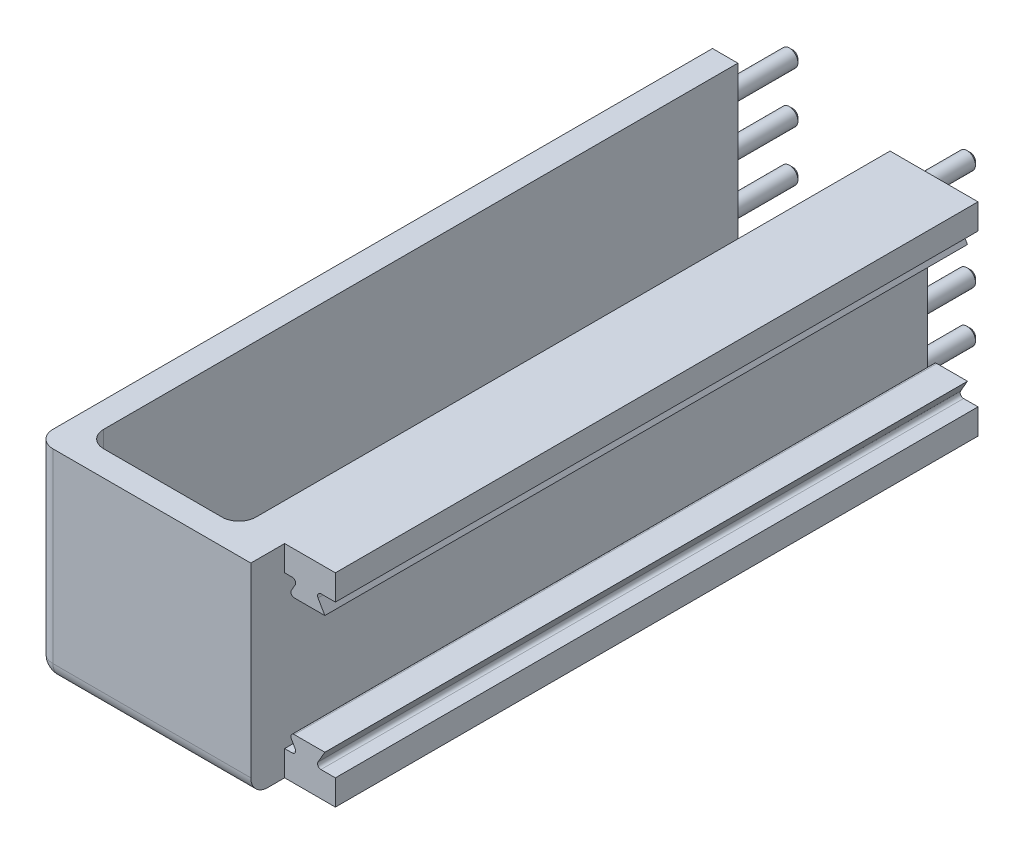
from build123d import *

# Parameters (mm, degrees)
SURFACE_EXTRUDE1_1_DEPTH = 120
THICKEN1_T2              = 15
SKETCH5_W                = 90
SKETCH5_H                = 120
CUT_EXTRUDE1_DEPTH       = 120
SKETCH4_W                = 120
SKETCH4_H                = 400
THICKEN2_T1              = 12
FILLET1_R                = 10
FILLET2_R                = 10
SKETCH6_R                = 5
BOSS_EXTRUDE1_DEPTH      = 40
CHAMFER1_SIZE            = 2
CHAMFER2_SIZE            = 2
SKETCH7_W                = 380
SKETCH7_H                = 120
BOSS_EXTRUDE2_DEPTH      = 40
CUT_EXTRUDE2_DEPTH       = 380
SKETCH9_W                = 3
SKETCH9_H                = 120
CUT_EXTRUDE3_DEPTH       = 440
FILLET4_R                = 2
FILLET5_R                = 2
SKETCH10_W               = 40
SKETCH10_H               = 120
CUT_EXTRUDE4_DEPTH       = 20
SKETCH11_W               = 20
SKETCH11_H               = 120
BOSS_EXTRUDE3_DEPTH      = 10
FILLET6_R                = 10


with BuildPart() as body_1:
    # Surface-Extrude1: a surface, the sketch's curves swept straight by 120 mm
    with BuildLine(Plane(origin=(0, 0, 0), x_dir=(1, 0, 0), z_dir=(0, 1, 0)), mode=Mode.PRIVATE) as surface_extrude1_1_path:
        Line((60, -200), (-60, -200))
        Line((-60, -200), (-60, 200))
        Line((-60, 200), (60, 200))
        Line((60, 200), (60, -200))
    surface_extrude1_1 = Shell.extrude(surface_extrude1_1_path.wire(), (0 * SURFACE_EXTRUDE1_1_DEPTH, 1 * SURFACE_EXTRUDE1_1_DEPTH, 0 * SURFACE_EXTRUDE1_1_DEPTH))
    add(Solid.thicken(surface_extrude1_1, -THICKEN1_T2))

    # Sketch5 → Cut-Extrude1 (cut)
    with BuildSketch(Plane.XY.offset(-185)):
        with Locations((0, 60)):
            Rectangle(SKETCH5_W, SKETCH5_H)
    extrude(amount=-CUT_EXTRUDE1_DEPTH, mode=Mode.SUBTRACT)

    # Sketch4 → Surface-Plane1: a flat surface bounded by the sketch
    with BuildSketch(Plane(origin=(0, 0, 0), x_dir=(1, 0, 0), z_dir=(0, 1, 0)), mode=Mode.PRIVATE) as surface_plane1_2_region:
        Rectangle(SKETCH4_W, SKETCH4_H)
    surface_plane1_2 = surface_plane1_2_region.sketch.faces()[0]
    add(Solid.thicken(surface_plane1_2, THICKEN2_T1))

    # Fillet1
    fillet1_edges = [body_1.edges().sort_by_distance(p)[0] for p in [
        (45, 66, 185),
        (45, 12, -7.5),
        (-45, 66, 185),
        (0, 12, 185),
        (-45, 12, -7.5),
    ]]
    fillet(fillet1_edges, radius=FILLET1_R)

    # Fillet2
    fillet2_edges = [body_1.edges().sort_by_distance(p)[0] for p in [
        (-60, 60, 200),
    ]]
    fillet(fillet2_edges, radius=FILLET2_R)

    # Sketch6 → Boss-Extrude1 (add)
    with BuildSketch(Plane(origin=(0, 0, -200), x_dir=(-1, 0, 0), z_dir=(0, 0, -1))):
        with Locations((-52.5, 100)):
            Circle(SKETCH6_R)
        with Locations((52.5, 100)):
            Circle(SKETCH6_R)
        with Locations((-52.5, 70)):
            Circle(SKETCH6_R)
        with Locations((-52.5, 40)):
            Circle(SKETCH6_R)
        with Locations((-52.5, 10)):
            Circle(SKETCH6_R)
        with Locations((52.5, 70)):
            Circle(SKETCH6_R)
        with Locations((52.5, 40)):
            Circle(SKETCH6_R)
        with Locations((52.5, 10)):
            Circle(SKETCH6_R)
    extrude(amount=BOSS_EXTRUDE1_DEPTH)

    # Chamfer1
    chamfer1_edges = [body_1.edges().sort_by_distance(p)[0] for p in [
        (57.5, 100, -240),
        (57.5, 70, -240),
        (57.5, 40, -240),
        (57.5, 10, -240),
    ]]
    chamfer(chamfer1_edges, length=CHAMFER1_SIZE)

    # Chamfer2
    chamfer2_edges = [body_1.edges().sort_by_distance(p)[0] for p in [
        (-47.5, 100, -240),
        (-47.5, 70, -240),
        (-47.5, 40, -240),
        (-47.5, 10, -240),
    ]]
    chamfer(chamfer2_edges, length=CHAMFER2_SIZE)

    # Sketch7 → Boss-Extrude2 (add)
    with BuildSketch(Plane(origin=(60, 0, 0), x_dir=(0, 0, -1), z_dir=(1, 0, 0))):
        with Locations((10, 60)):
            Rectangle(SKETCH7_W, SKETCH7_H)
    extrude(amount=BOSS_EXTRUDE2_DEPTH)

    # Sketch8 → Cut-Extrude2 (cut)
    with BuildSketch(Plane(origin=(0, 0, -200), x_dir=(-1, 0, 0), z_dir=(0, 0, -1))):
        Polygon((-97, 105), (-100, 105), (-100, 15), (-97, 15), (-85, 15), (-90.773502692, 25), (-85, 25), (-80, 25), (-80, 95), (-85, 95), (-90.773502692, 95), (-85, 105), align=None)
        Polygon((-75, 95), (-80, 95), (-80, 25), (-75, 25), (-69.226497308, 25), (-75, 15), (-67, 15), (-67, 105), (-75, 105), (-69.226497308, 95), align=None)
    extrude(amount=-CUT_EXTRUDE2_DEPTH, mode=Mode.SUBTRACT)

    # Sketch9 → Cut-Extrude3 (cut)
    with BuildSketch(Plane(origin=(0, 0, -200), x_dir=(-1, 0, 0), z_dir=(0, 0, -1))):
        with Locations((-98.5, 60)):
            Rectangle(SKETCH9_W, SKETCH9_H)
    extrude(amount=-CUT_EXTRUDE3_DEPTH, mode=Mode.SUBTRACT)

    # Fillet4
    fillet4_edges = [body_1.edges().sort_by_distance(p)[0] for p in [
        (85, 15, -10),
        (85, 105, -10),
        (75, 105, -10),
        (75, 15, -10),
    ]]
    fillet(fillet4_edges, radius=FILLET4_R)

    # Fillet5
    fillet5_edges = [body_1.edges().sort_by_distance(p)[0] for p in [
        (69.226497308, 25, -10),
        (69.226497308, 95, -10),
    ]]
    fillet(fillet5_edges, radius=FILLET5_R)

    # Sketch10 → Cut-Extrude4 (cut)
    with BuildSketch(Plane.XY.offset(180)):
        with Locations((77, 60)):
            Rectangle(SKETCH10_W, SKETCH10_H)
    extrude(amount=CUT_EXTRUDE4_DEPTH, mode=Mode.SUBTRACT)

    # Sketch11 → Boss-Extrude3 (add)
    with BuildSketch(Plane(origin=(57, 0, 0), x_dir=(0, 0, -1), z_dir=(1, 0, 0))):
        with Locations((-190, 60)):
            Rectangle(SKETCH11_W, SKETCH11_H)
    extrude(amount=BOSS_EXTRUDE3_DEPTH)

    # Fillet6
    fillet6_edges = [body_1.edges().sort_by_distance(p)[0] for p in [
        (8.5, 0, 200),
        (-57.071067812, 0, 197.071067812),
        (-60, 0, -5),
    ]]
    fillet(fillet6_edges, radius=FILLET6_R)


solid = body_1.part
